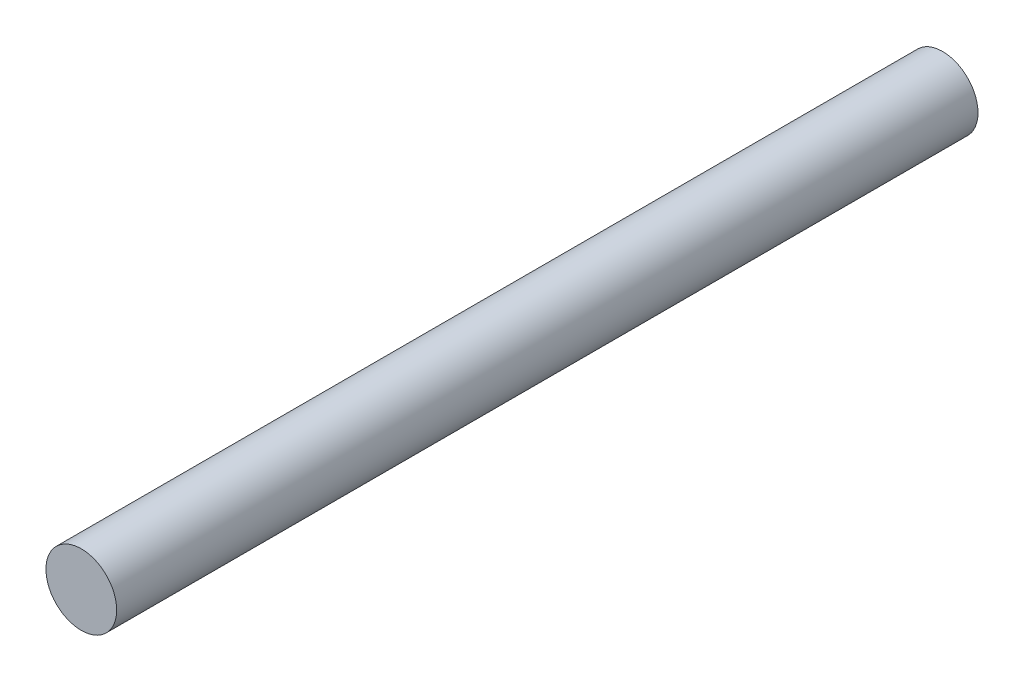
from build123d import *

# Parameters (mm, degrees)
SKETCH1_R           = 2
BOSS_EXTRUDE1_DEPTH = 48.7


with BuildPart() as part:
    # Sketch1 → Boss-Extrude1 (new body)
    with BuildSketch(Plane.XY):
        with Locations((0, 1.019669478)):
            Circle(SKETCH1_R)
    extrude(amount=BOSS_EXTRUDE1_DEPTH)


solid = part.part
